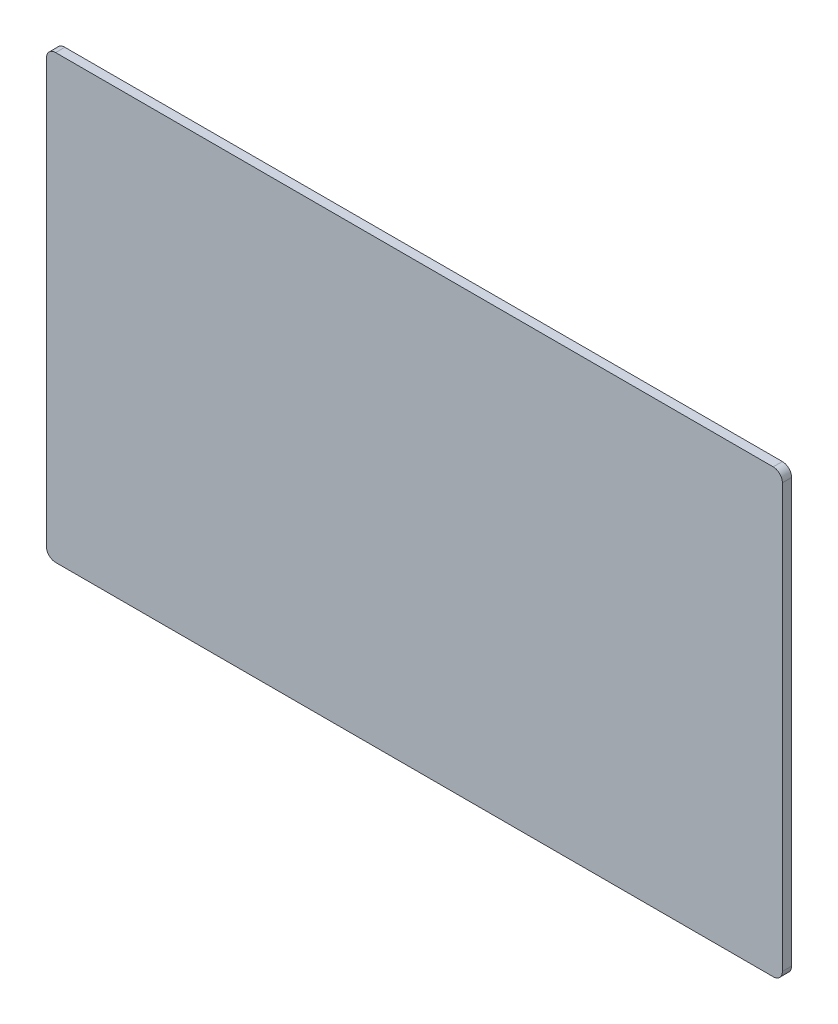
from build123d import *

# Parameters (mm, degrees)
SKETCH1_W           = 508
SKETCH1_H           = 304.8
BOSS_EXTRUDE1_DEPTH = 6.35
FILLET1_R           = 6.35


with BuildPart() as part:
    # Sketch1 → Boss-Extrude1 (new body)
    with BuildSketch(Plane.XY):
        with Locations((254, 152.4)):
            Rectangle(SKETCH1_W, SKETCH1_H)
    extrude(amount=BOSS_EXTRUDE1_DEPTH)

    # Fillet1
    fillet1_edges = [part.edges().sort_by_distance(p)[0] for p in [
        (0, 304.8, 3.175),
        (508, 304.8, 3.175),
        (508, 0, 3.175),
        (0, 0, 3.175),
    ]]
    fillet(fillet1_edges, radius=FILLET1_R)


solid = part.part
